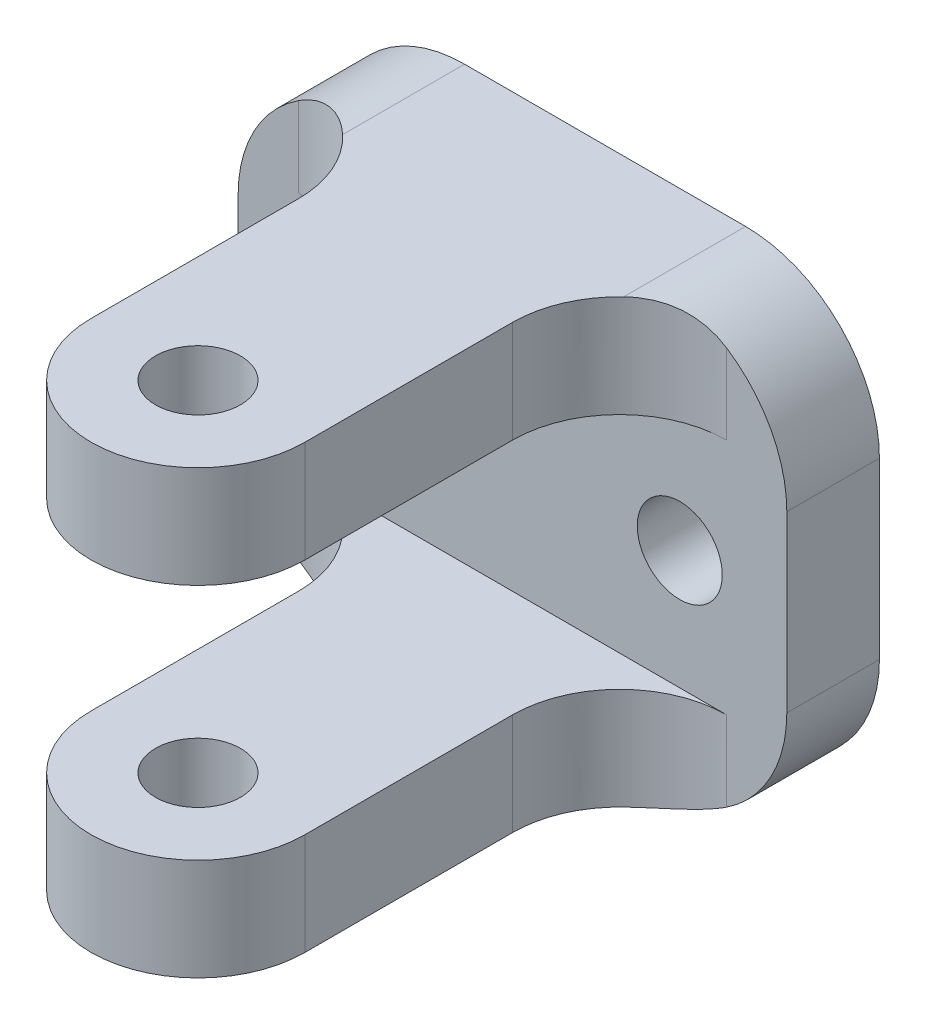
from build123d import *

# Parameters (mm, degrees)
SKETCH1_W                      = 41
SKETCH1_H                      = 33.02
SKETCH1_R                      = 3.175
BOSS_EXTRUDE1_DEPTH            = 12
SKETCH2_W                      = 41
SKETCH2_H                      = 7.62
BOSS_EXTRUDE2_DEPTH            = 53
CUT_EXTRUDE1_REACH             = 72.127
SKETCH4_R                      = 3.175
CUT_EXTRUDE1_DIRECTION_2_REACH = 72.127
CUT_EXTRUDE3_REACH             = 72.127
CUT_EXTRUDE3_DIRECTION_2_REACH = 72.127
FILLET1_R                      = 10
CUT_EXTRUDE4_DEPTH             = 5.08


with BuildPart() as part:
    # Sketch1 → Boss-Extrude1 (new body)
    with BuildSketch(Plane.XY):
        Rectangle(SKETCH1_W, SKETCH1_H)
        with Locations((12.5, 0)):
            Circle(SKETCH1_R, mode=Mode.SUBTRACT)
        with Locations((-12.5, 0)):
            Circle(SKETCH1_R, mode=Mode.SUBTRACT)
    extrude(amount=BOSS_EXTRUDE1_DEPTH)

    # Sketch2 → Boss-Extrude2 (add)
    with BuildSketch(Plane.XY.offset(12)):
        with Locations((0, 12.7)):
            Rectangle(SKETCH2_W, SKETCH2_H)
        with Locations((0, -12.7)):
            Rectangle(SKETCH2_W, SKETCH2_H)
    extrude(amount=BOSS_EXTRUDE2_DEPTH)

    # Cut-Extrude1: up to this face of the body (flat: up to its plane)
    cut_extrude1_end = Plane(part.part.faces().sort_by_distance((0, -16.51, 32.5))[0])
    # Sketch4 → Cut-Extrude1 (cut, up to the picked face)
    with BuildSketch(Plane(origin=(0, 0, 0), x_dir=(1, 0, 0), z_dir=(0, 1, 0)), mode=Mode.PRIVATE) as cut_extrude1_sk1:
        with Locations(Location((0, -35.5, 0), (0, 0, 270))):
            Circle(SKETCH4_R)
    cut_extrude1_tool1 = split(extrude(cut_extrude1_sk1.sketch, amount=-CUT_EXTRUDE1_REACH, mode=Mode.PRIVATE), bisect_by=cut_extrude1_end, keep=Keep.BOTH, mode=Mode.PRIVATE)
    add(cut_extrude1_tool1.solids().sort_by(Axis((0, 0, 35.5), (0, -1, 0)))[0], mode=Mode.SUBTRACT)

    # Cut-Extrude1 direction 2: up to this face of the body (flat: up to its plane)
    cut_extrude1_direction_2_end = Plane(part.part.faces().sort_by_distance((0, 16.51, 32.5))[0])
    # Sketch4 → Cut-Extrude1 direction 2 (cut, up to the picked face)
    with BuildSketch(Plane(origin=(0, 0, 0), x_dir=(1, 0, 0), z_dir=(0, 1, 0)), mode=Mode.PRIVATE) as cut_extrude1_direction_2_sk1:
        with Locations(Location((0, -35.5, 0), (0, 0, 270))):
            Circle(SKETCH4_R)
    cut_extrude1_direction_2_tool1 = split(extrude(cut_extrude1_direction_2_sk1.sketch, amount=CUT_EXTRUDE1_DIRECTION_2_REACH, mode=Mode.PRIVATE), bisect_by=cut_extrude1_direction_2_end, keep=Keep.BOTH, mode=Mode.PRIVATE)
    add(cut_extrude1_direction_2_tool1.solids().sort_by(Axis((0, 0, 35.5), (0, 1, 0)))[0], mode=Mode.SUBTRACT)

    # Cut-Extrude3: up to this face of the body (flat: up to its plane)
    cut_extrude3_end = Plane(part.part.faces().sort_by_distance((-19.731494958, -16.51, 32.5))[0])
    # Sketch6 → Cut-Extrude3 (cut, up to the picked face)
    with BuildSketch(Plane(origin=(0, 0, 0), x_dir=(1, 0, 0), z_dir=(0, 1, 0)), mode=Mode.PRIVATE) as cut_extrude3_sk1:
        with BuildLine():
            Line((-8, -35.5), (-8, -20))
            ThreePointArc((-8, -20), (-10.343145751, -14.343145751), (-16, -12))
            Line((-16, -12), (-20.5, -12))
            Line((-20.5, -12), (-20.5, -65))
            Line((-20.5, -65), (20.5, -65))
            Line((20.5, -65), (20.5, -12))
            Line((20.5, -12), (16, -12))
            ThreePointArc((16, -12), (10.343145751, -14.343145751), (8, -20))
            Line((8, -20), (8, -35.5))
            ThreePointArc((8, -35.5), (0, -43.5), (-8, -35.5))
        make_face()
    cut_extrude3_tool1 = split(extrude(cut_extrude3_sk1.sketch, amount=-CUT_EXTRUDE3_REACH, mode=Mode.PRIVATE), bisect_by=cut_extrude3_end, keep=Keep.BOTH, mode=Mode.PRIVATE)
    add(cut_extrude3_tool1.solids().sort_by(Axis((-8.670075, 0, 27.75), (0, -1, 0)))[0], mode=Mode.SUBTRACT)

    # Cut-Extrude3 direction 2: up to this face of the body (flat: up to its plane)
    cut_extrude3_direction_2_end = Plane(part.part.faces().sort_by_distance((19.731494958, 16.51, 32.5))[0])
    # Sketch6 → Cut-Extrude3 direction 2 (cut, up to the picked face)
    with BuildSketch(Plane(origin=(0, 0, 0), x_dir=(1, 0, 0), z_dir=(0, 1, 0)), mode=Mode.PRIVATE) as cut_extrude3_direction_2_sk1:
        with BuildLine():
            Line((-8, -35.5), (-8, -20))
            ThreePointArc((-8, -20), (-10.343145751, -14.343145751), (-16, -12))
            Line((-16, -12), (-20.5, -12))
            Line((-20.5, -12), (-20.5, -65))
            Line((-20.5, -65), (20.5, -65))
            Line((20.5, -65), (20.5, -12))
            Line((20.5, -12), (16, -12))
            ThreePointArc((16, -12), (10.343145751, -14.343145751), (8, -20))
            Line((8, -20), (8, -35.5))
            ThreePointArc((8, -35.5), (0, -43.5), (-8, -35.5))
        make_face()
    cut_extrude3_direction_2_tool1 = split(extrude(cut_extrude3_direction_2_sk1.sketch, amount=CUT_EXTRUDE3_DIRECTION_2_REACH, mode=Mode.PRIVATE), bisect_by=cut_extrude3_direction_2_end, keep=Keep.BOTH, mode=Mode.PRIVATE)
    add(cut_extrude3_direction_2_tool1.solids().sort_by(Axis((-8.670075, 0, 27.75), (0, 1, 0)))[0], mode=Mode.SUBTRACT)

    # Fillet1
    fillet1_edges = [part.edges().sort_by_distance(p)[0] for p in [
        (-20.5, -16.51, 6),
        (-20.5, 16.51, 6),
        (20.5, -16.51, 6),
        (20.5, 16.51, 6),
    ]]
    fillet(fillet1_edges, radius=FILLET1_R)

    # Sketch7 → Cut-Extrude4 (cut)
    with BuildSketch(Plane(origin=(0, 0, 0), x_dir=(-1, 0, 0), z_dir=(0, 0, -1))):
        with BuildLine():
            Line((-10.5, -16.51), (10.5, -16.51))
            ThreePointArc((10.5, -16.51), (17.571067812, -13.581067812), (20.5, -6.51))
            Line((20.5, -6.51), (20.5, 6.51))
            ThreePointArc((20.5, 6.51), (17.571067812, 13.581067812), (10.5, 16.51))
            Line((10.5, 16.51), (-10.5, 16.51))
            ThreePointArc((-10.5, 16.51), (-17.571067812, 13.581067812), (-20.5, 6.51))
            Line((-20.5, 6.51), (-20.5, -6.51))
            ThreePointArc((-20.5, -6.51), (-17.571067812, -13.581067812), (-10.5, -16.51))
        make_face()
    extrude(amount=-CUT_EXTRUDE4_DEPTH, mode=Mode.SUBTRACT)


solid = part.part
